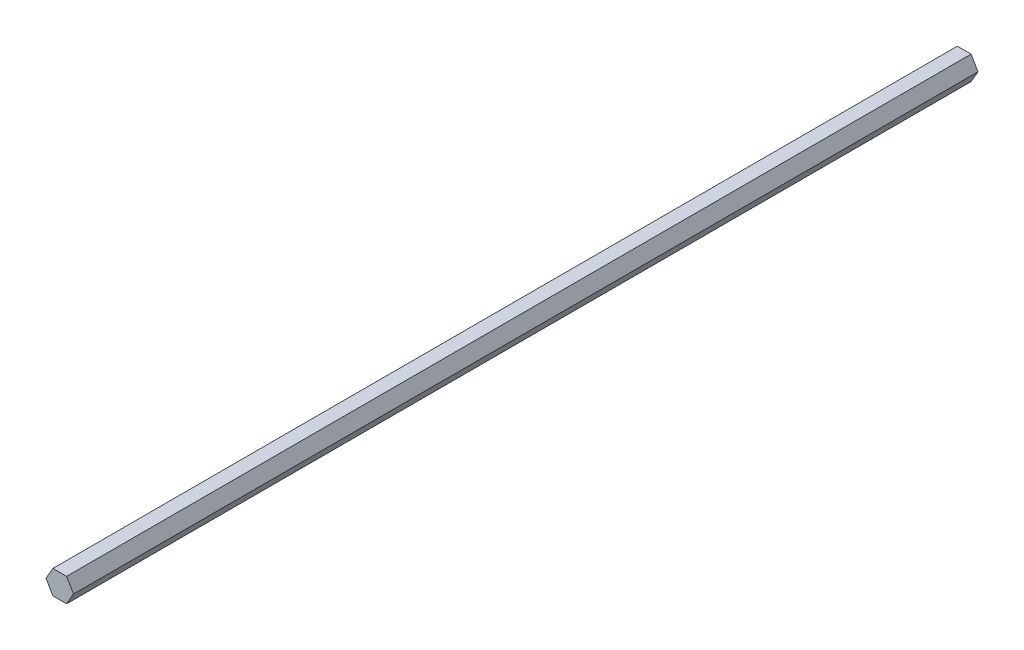
from build123d import *

# Parameters (mm, degrees)
BOSS_EXTRUDE1_DEPTH = 241.3


with BuildPart() as part:
    # Sketch2 → Boss-Extrude1 (new, symmetric)
    with BuildSketch(Plane.XY):
        Polygon((3.666174209, -6.35), (7.332348419, 0), (3.666174209, 6.35), (-3.666174209, 6.35), (-7.332348419, 0), (-3.666174209, -6.35), align=None)
    extrude(amount=BOSS_EXTRUDE1_DEPTH, both=True)


solid = part.part
